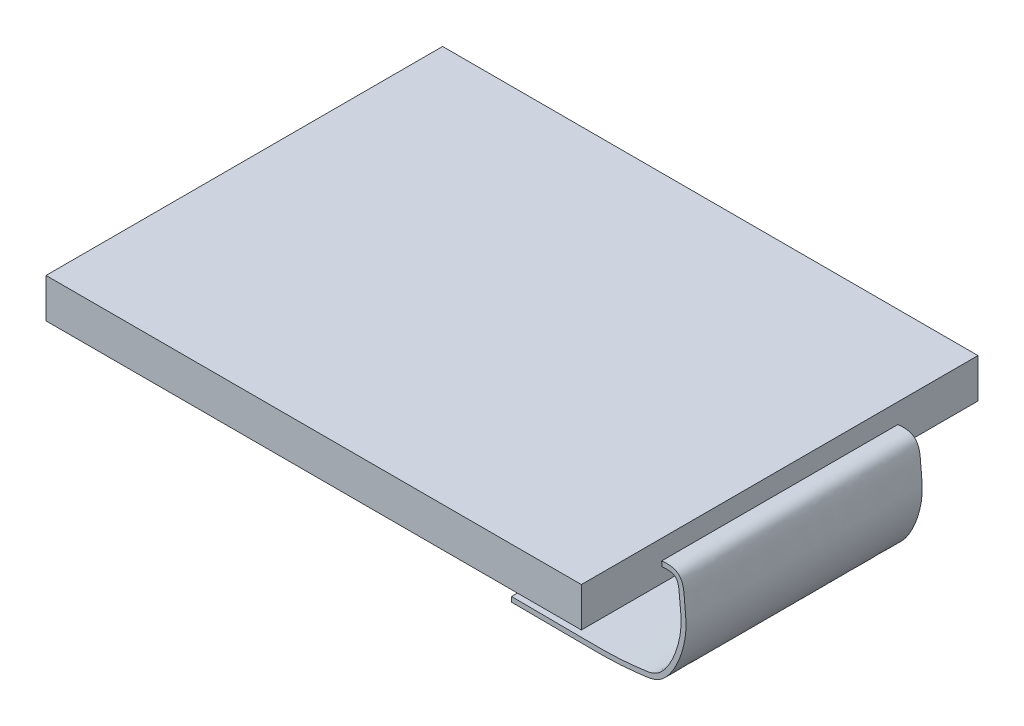
from build123d import *

# Parameters (mm, degrees)
SKETCH1_W                = 54.4
SKETCH1_H                = 40.3
BOSS_EXTRUDE1_DEPTH      = 4
BOSS_EXTRUDE2_DEPTH      = 12
BOSS_EXTRUDE2_DEPTH_BACK = 12


with BuildPart() as part:
    # Sketch1 → Boss-Extrude1 (new body)
    with BuildSketch(Plane(origin=(0, 0, 0), x_dir=(1, 0, 0), z_dir=(0, 1, 0))):
        Rectangle(SKETCH1_W, SKETCH1_H)
    extrude(amount=BOSS_EXTRUDE1_DEPTH)


with BuildPart() as body_2:
    # Sketch2 → Boss-Extrude2 (new, two sides: drawn at the far end of the back side and taken through both)
    with BuildSketch(Plane.XY.offset(-BOSS_EXTRUDE2_DEPTH_BACK)):
        with BuildLine():
            Line((27.2, 2), (27.265425298, 1.504298951))
            add(Edge.make_bspline(
                [(27.265425298, 1.504298951), (27.386154399, 1.520233429), (27.644982774, 1.543619289), (28.037083725, 1.537334839), (28.386397309, 1.457640569), (28.612300728, 1.311032107), (28.774048976, 1.102843304), (28.900556663, 0.771743175), (29.007866205, 0.185663718), (29.050539896, -0.761010912), (29.194523642, -1.894649451), (29.18663713, -2.972293861), (28.996026008, -4.141551258), (28.5484368, -5.660533694), (27.860543886, -7.004026934), (27.081612623, -7.889530814), (26.529154623, -8.248154642), (25.944024988, -8.430669855), (25.308818388, -8.51497167), (24.678459334, -8.586111732), (23.917487648, -8.665070283), (23.047916579, -8.736234924), (22.05553748, -8.785755813), (21.017794747, -8.807063394), (19.844723117, -8.80742854), (18.448007358, -8.794210167), (17.025431453, -8.778174866), (15.688145144, -8.766147307), (14.575570532, -8.758480137), (13.54462521, -8.754012365), (12.65950613, -8.752066795), (12.183276318, -8.751716127), (11.949370105, -8.751716127)],
                knots=[0, 0, 0, 0, 0.0078125, 0.015625, 0.03125, 0.046875, 0.0625, 0.078125, 0.09375, 0.125, 0.15625, 0.1875, 0.21875, 0.25, 0.3125, 0.34375, 0.375, 0.40625, 0.4375, 0.46875, 0.5, 0.5625, 0.625, 0.6875, 0.75, 0.8125, 0.875, 0.90625, 0.9375, 0.96875, 0.984375, 1, 1, 1, 1], degree=3))
            Line((11.949370105, -8.751716127), (11.949370105, -9.251716127))
            add(Edge.make_bspline(
                [(27.2, 2), (29.563910735, 2.31200169), (29.402821993, 0.263414704), (29.979123484, -3.957384849), (28.036653444, -8.666537098), (21.582884985, -9.511161553), (20.534574117, -9.251716127), (11.949370105, -9.251716127)],
                knots=[0, 0, 0, 0, 0.127111935, 0.164895416, 0.354174869, 0.44005132, 1, 1, 1, 1], degree=3))
        make_face()
    extrude(amount=BOSS_EXTRUDE2_DEPTH + BOSS_EXTRUDE2_DEPTH_BACK)


solid = Compound([part.part, body_2.part])
